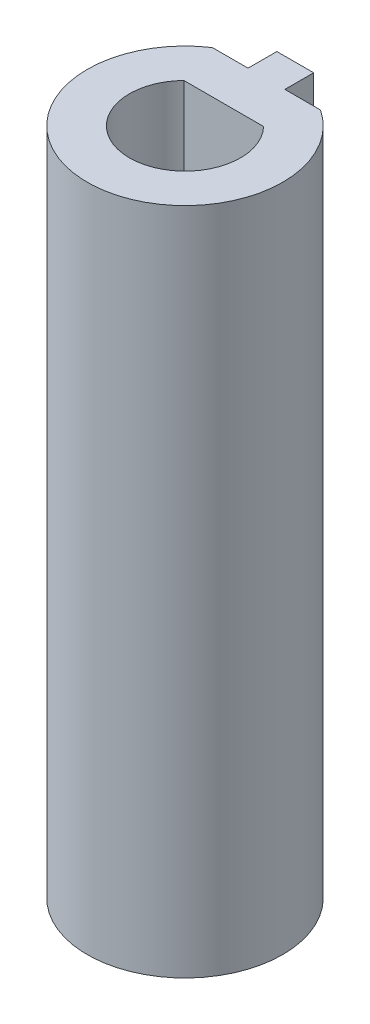
from build123d import *

# Parameters (mm, degrees)
EXTRUDE_1_DEPTH = 19.5


with BuildPart() as part:
    # 草图1 → 凸台-拉伸1 (new body)
    with BuildSketch(Plane(origin=(0, 0, 0), x_dir=(1, 0, 0), z_dir=(0, 1, 0))):
        with BuildLine():
            Line((-0.536355181, 3.215077001), (-0.536355181, 2.375))
            Line((-0.536355181, 2.375), (-1.575396775, 2.375))
            ThreePointArc((-1.575396775, 2.375), (0, -2.85), (1.575396775, 2.375))
            Line((1.575396775, 2.375), (0.536355181, 2.375))
            Line((0.536355181, 2.375), (0.536355181, 3.215077001))
            Line((0.536355181, 3.215077001), (-0.536355181, 3.215077001))
        make_face()
        with BuildLine():
            ThreePointArc((1.162358254, 1.128416275), (0, -1.62), (-1.162358254, 1.128416275))
            Line((-1.162358254, 1.128416275), (1.162358254, 1.128416275))
        make_face(mode=Mode.SUBTRACT)
    extrude(amount=EXTRUDE_1_DEPTH)


solid = part.part
